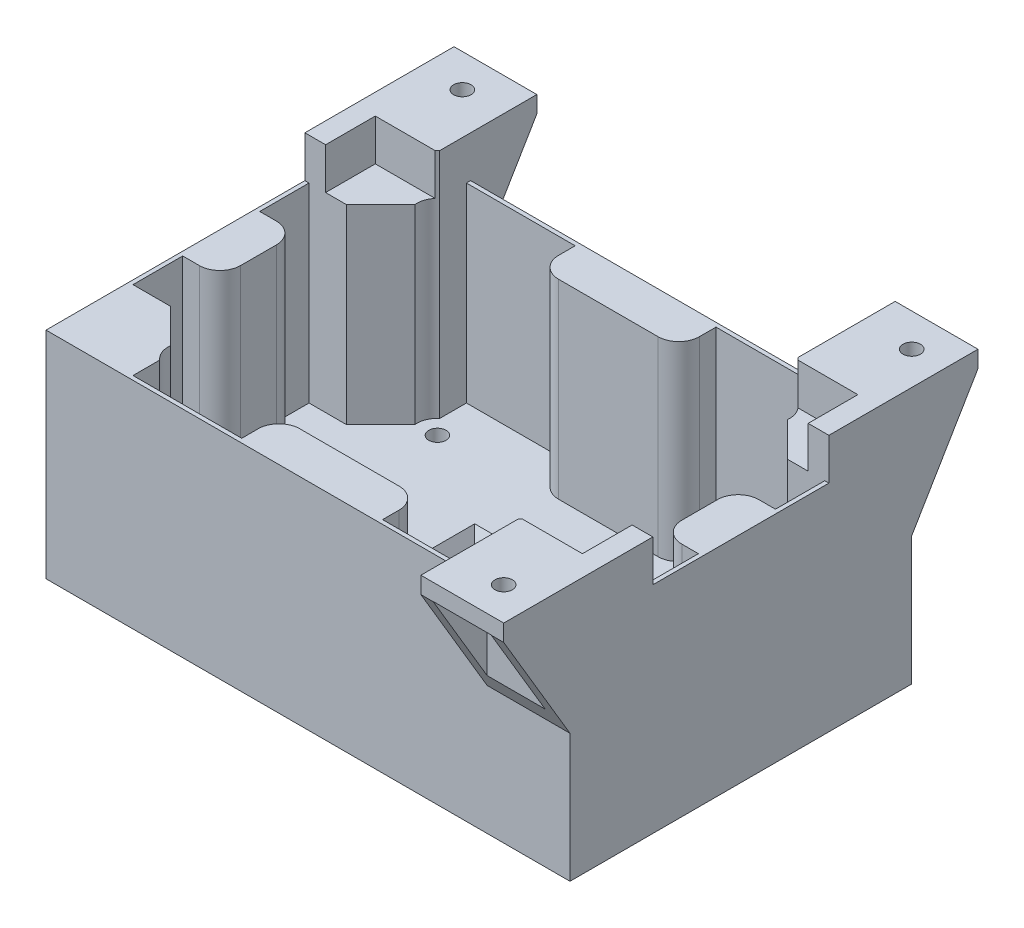
from build123d import *

# Parameters (mm, degrees)
SKETCH_1_W               = 126.5
SKETCH_1_H               = 82.5
SKETCH_1_R               = 2.1
SKETCH_1_W_2             = 30
SKETCH_1_H_2             = 28
EXTRUDE_2_DEPTH          = 6
CHAMFER_1_SIZE           = 2
CHAMFER_1_SIZE2          = 3.464101615
SKETCH_2_W               = 34
SKETCH_2_H               = 10
SKETCH_2_W_2             = 10
SKETCH_2_H_2             = 18.59934511
SKETCH_2_W_3             = 1
SKETCH_2_H_3             = 11.900654894
SKETCH_2_H_4             = 18.599345106
SKETCH_2_H_5             = 12
SKETCH_2_W_4             = 26.25
SKETCH_2_H_6             = 1
SKETCH_2_H_7             = 11.999999996
EXTRUDE_3_DEPTH          = 46
EXTRUDE_4_DEPTH          = 10
EXTRUDE_7_DEPTH          = 20
EXTRUDE_8_DEPTH          = 20
CUT_EXTRUDE_1_DEPTH      = 205.414906938
CUT_EXTRUDE_1_DEPTH_BACK = 205.414906938
SKETCH_6_R               = 2.1
SKETCH_7_W               = 14
SKETCH_7_H               = 13.763943164
SKETCH_7_H_2             = 13.67346934
SKETCH_7_H_3             = 14.015580363
SKETCH_7_H_4             = 13.891937121
CUT_EXTRUDE_2_DEPTH      = 58
FILLET_1_R               = 5
SKETCH_9_R               = 5
CUT_EXTRUDE_4_DEPTH      = 203.675736531


with BuildPart() as part:
    # Эскиз1 → Бобышка-Вытянуть2 (new body)
    with BuildSketch(Plane(origin=(0, 77.195974268, 0), x_dir=(1, 0, 0), z_dir=(0, 1, 0))):
        with Locations((64.808980694, -89.523129836)):
            Rectangle(SKETCH_1_W, SKETCH_1_H)
        with Locations(Location((24.808980694, -59.523129836, 0), (0, 0, 180))):
            Circle(SKETCH_1_R, mode=Mode.SUBTRACT)
        with Locations(Location((104.808980694, -59.523129836, 0), (0, 0, 180))):
            Circle(SKETCH_1_R, mode=Mode.SUBTRACT)
        with Locations(Location((104.808980694, -119.523129836, 0), (0, 0, 180))):
            Circle(SKETCH_1_R, mode=Mode.SUBTRACT)
        with Locations(Location((24.808980694, -119.523129836, 0), (0, 0, 180))):
            Circle(SKETCH_1_R, mode=Mode.SUBTRACT)
        with Locations((64.808980694, -89.523129836)):
            Rectangle(SKETCH_1_W_2, SKETCH_1_H_2, mode=Mode.SUBTRACT)
    extrude(amount=EXTRUDE_2_DEPTH)

    # Фаска1
    chamfer_1_edges = [part.edges().sort_by_distance(p)[0] for p in [
        (49.808980694, 83.195974268, 89.523129836),
        (64.808980694, 83.195974268, 103.523129836),
        (79.808980694, 83.195974268, 89.523129836),
        (64.808980694, 83.195974268, 75.523129836),
    ]]
    chamfer_1_side = [part.faces().sort_by_distance(p)[0] for p in [
        (64.808980694, 83.195974268, 49.78337816),
    ]]
    chamfer(chamfer_1_edges, length=CHAMFER_1_SIZE, length2=CHAMFER_1_SIZE2, reference=chamfer_1_side[0])

    # Эскиз2 → Бобышка-Вытянуть3 (add)
    with BuildSketch(Plane(origin=(0, 83.195974268, 0), x_dir=(1, 0, 0), z_dir=(0, 1, 0))):
        Polygon((1.558980694, -68.273129836), (11.558980694, -68.273129836), (21.558980694, -58.273129836), (21.558980694, -48.273129836), (1.558980694, -48.273129836), align=None)
        with Locations((64.808980694, -53.273129836)):
            Rectangle(SKETCH_2_W, SKETCH_2_H)
        Polygon((118.058980694, -68.273129836), (108.058980694, -58.273129836), (108.058980694, -48.273129836), (128.058980694, -48.273129836), (128.058980694, -68.273129836), align=None)
        with Locations((123.058980694, -89.473457285)):
            Rectangle(SKETCH_2_W_2, SKETCH_2_H_2)
        Polygon((108.058980694, -120.773129836), (118.058980694, -110.773129836), (128.058980694, -110.773129836), (128.058980694, -130.773129836), (108.058980694, -130.773129836), align=None)
        with Locations((64.808980694, -125.773129836)):
            Rectangle(SKETCH_2_W, SKETCH_2_H)
        Polygon((21.558980694, -130.773129836), (21.558980694, -120.773129836), (11.558980694, -110.773129836), (1.558980694, -110.773129836), (1.558980694, -130.773129836), align=None)
        with Locations((2.058980694, -74.223457283)):
            Rectangle(SKETCH_2_W_3, SKETCH_2_H_3)
        with Locations((6.558980694, -89.473457283)):
            Rectangle(SKETCH_2_W_2, SKETCH_2_H_4)
        with Locations((2.058980694, -104.773129836)):
            Rectangle(SKETCH_2_W_3, SKETCH_2_H_5)
        with Locations((34.683980694, -130.273129836)):
            Rectangle(SKETCH_2_W_4, SKETCH_2_H_6)
        with Locations((94.933980694, -130.273129836)):
            Rectangle(SKETCH_2_W_4, SKETCH_2_H_6)
        with Locations((127.558980694, -104.773129838)):
            Rectangle(SKETCH_2_W_3, SKETCH_2_H_7)
        with Locations((127.558980694, -74.223457283)):
            Rectangle(SKETCH_2_W_3, SKETCH_2_H_3)
        with Locations((94.933980694, -48.773129836)):
            Rectangle(SKETCH_2_W_4, SKETCH_2_H_6)
        with Locations((34.683980694, -48.773129836)):
            Rectangle(SKETCH_2_W_4, SKETCH_2_H_6)
    extrude(amount=EXTRUDE_3_DEPTH)

    # Эскиз3 → Бобышка-Вытянуть4 (add)
    with BuildSketch(Plane(origin=(0, 129.195974268, 0), x_dir=(1, 0, 0), z_dir=(0, 1, 0))):
        Polygon((6.558980694, -68.273129836), (6.558980694, -56.273129836), (21.558980694, -56.273129836), (21.558980694, -48.273129836), (1.558980694, -48.273129836), (1.558980694, -68.273129836), align=None)
        Polygon((123.058980694, -68.273129836), (123.058980694, -56.273129836), (108.058980694, -56.273129836), (108.058980694, -48.273129836), (128.058980694, -48.273129836), (128.058980694, -68.273129836), align=None)
        Polygon((123.058980694, -110.773129836), (123.058980694, -122.773129836), (108.058980694, -122.773129836), (108.058980694, -130.773129836), (128.058980694, -130.773129836), (128.058980694, -110.773129836), align=None)
    extrude(amount=EXTRUDE_4_DEPTH)

    # Эскиз4 → Бобышка-Вытянуть7 (add)
    with BuildSketch(Plane.ZY.offset(-1.558980694)):
        Polygon((48.273129836, 139.195974268), (48.273129836, 108.195974268), (32.273129836, 135.145974268), (32.273129836, 139.195974268), align=None)
    extrude(amount=-EXTRUDE_7_DEPTH)

    # Эскиз5 → Бобышка-Вытянуть8 (add)
    with BuildSketch(Plane(origin=(128.058980694, 0, 0), x_dir=(0, 0, -1), z_dir=(1, 0, 0))):
        Polygon((-130.773129836, 139.195974268), (-130.773129836, 108.145974268), (-146.773129836, 135.145974268), (-146.773129836, 139.195974268), align=None)
        Polygon((-48.273129836, 139.195974268), (-48.273129836, 108.195974268), (-32.273129836, 135.145974268), (-32.273129836, 139.195974268), align=None)
    extrude(amount=-EXTRUDE_8_DEPTH)

    # Эскиз6 → Вырез-Вытянуть1 (cut, two sides: drawn at the far end of the back side and taken through both)
    with BuildSketch(Plane(origin=(0, 139.195974268, 0), x_dir=(1, 0, 0), z_dir=(0, 1, 0)).offset(-CUT_EXTRUDE_1_DEPTH_BACK)):
        with Locations(Location((120.058980694, -40.273129836, 0), (0, 0, 90))):
            Circle(SKETCH_6_R)
        with Locations(Location((11.55898069, -40.273129836, 0), (0, 0, 180))):
            Circle(SKETCH_6_R)
        with Locations((11.55898069, -138.773129836)):
            Circle(SKETCH_6_R)
        with Locations(Location((120.058980694, -138.773129836, 0), (0, 0, 180))):
            Circle(SKETCH_6_R)
    extrude(amount=CUT_EXTRUDE_1_DEPTH + CUT_EXTRUDE_1_DEPTH_BACK, mode=Mode.SUBTRACT)

    # Эскиз7 → Вырез-Вытянуть2 (cut)
    with BuildSketch(Plane(origin=(0, 77.195974268, 0), x_dir=(-1, 0, 0), z_dir=(0, -1, 0))):
        with Locations((-11.558980694, -38.391158254)):
            Rectangle(SKETCH_7_W, SKETCH_7_H)
        with Locations((-118.058980694, -38.436395166)):
            Rectangle(SKETCH_7_W, SKETCH_7_H_2)
        with Locations((-118.058980694, -140.780920018)):
            Rectangle(SKETCH_7_W, SKETCH_7_H_3)
        with Locations((-11.558980694, -140.719098397)):
            Rectangle(SKETCH_7_W, SKETCH_7_H_4)
    extrude(amount=-CUT_EXTRUDE_2_DEPTH, mode=Mode.SUBTRACT)

    # Скругление1
    fillet_1_edges = [part.edges().sort_by_distance(p)[0] for p in [
        (81.808980694, 106.195974268, 120.773129836),
        (47.808980694, 106.195974268, 120.773129836),
        (11.558980694, 106.195974268, 98.773129836),
        (11.558980694, 106.195974268, 80.17378473),
        (47.808980694, 106.195974268, 58.273129836),
        (81.808980694, 106.195974268, 58.273129836),
        (118.058980694, 106.195974268, 80.17378473),
        (118.058980694, 106.195974268, 98.77312984),
    ]]
    fillet(fillet_1_edges, radius=FILLET_1_R)

    # Эскиз9 → Вырез-Вытянуть4 (cut, through all)
    with BuildSketch(Plane(origin=(0, 83.195974268, 0), x_dir=(1, 0, 0), z_dir=(0, 1, 0))):
        with Locations((24.808980694, -59.523129836)):
            Circle(SKETCH_9_R)
        with Locations((104.808980694, -59.523129836)):
            Circle(SKETCH_9_R)
        with Locations((104.808980694, -119.523129836)):
            Circle(SKETCH_9_R)
        with Locations((24.808980694, -119.523129836)):
            Circle(SKETCH_9_R)
    extrude(amount=CUT_EXTRUDE_4_DEPTH, mode=Mode.SUBTRACT)


solid = part.part
